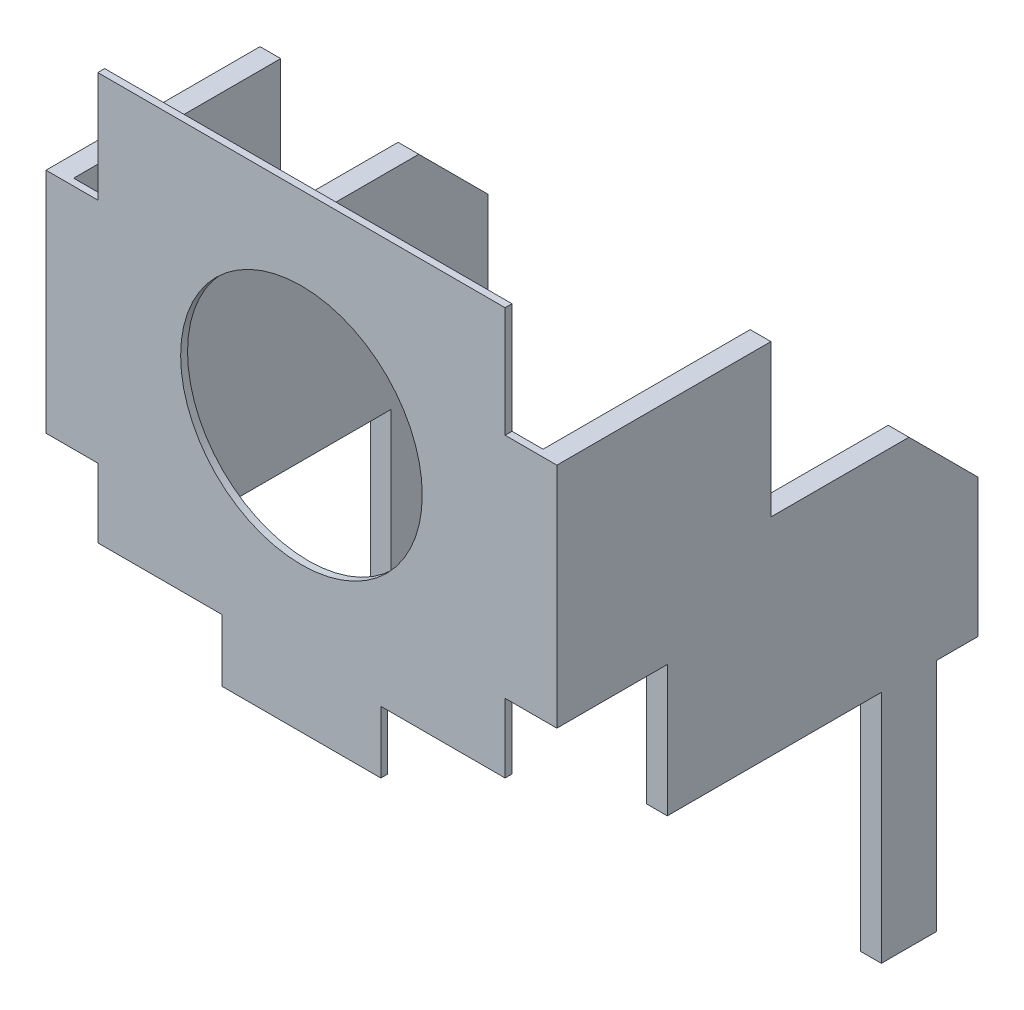
from build123d import *

# Parameters (mm, degrees)
SKETCH1_R                = 1.75
BOSS_EXTRUDE1_DEPTH      = 0.1
SKETCH2_W                = 0.3
SKETCH2_H                = 3.3
BOSS_EXTRUDE2_DEPTH      = 3
BOSS_EXTRUDE3_DEPTH      = 3
BOSS_EXTRUDE3_DEPTH_BACK = 1.5
SKETCH3_W                = 0.3
SKETCH3_H                = 3
CUT_EXTRUDE1_DEPTH       = 11.725320508
CUT_EXTRUDE1_DEPTH_BACK  = 11.725320508
SKETCH6_W                = 0.3
SKETCH6_H                = 0.8
BOSS_EXTRUDE4_DEPTH      = 3.4


with BuildPart() as part:
    # Sketch1 → Boss-Extrude1 (new body)
    with BuildSketch(Plane.XY):
        Polygon((1.8, 0), (1.8, -0.9), (4.1, -0.9), (4.1, 0), (5.9, 0), (5.9, 1), (6.65, 1), (6.65, 4.3), (5.9, 4.3), (5.9, 5.9), (0, 5.9), (0, 4.3), (-0.75, 4.3), (-0.75, 1), (0, 1), (0, 0), align=None)
        with Locations((2.95, 2.95)):
            Circle(SKETCH1_R, mode=Mode.SUBTRACT)
    extrude(amount=BOSS_EXTRUDE1_DEPTH)

    # Sketch2 → Boss-Extrude2 (add)
    with BuildSketch(Plane(origin=(0, 0, 0), x_dir=(-1, 0, 0), z_dir=(0, 0, -1))):
        with Locations((-6.5, 2.65)):
            Rectangle(SKETCH2_W, SKETCH2_H)
        with Locations((0.6, 2.65)):
            Rectangle(SKETCH2_W, SKETCH2_H)
    extrude(amount=BOSS_EXTRUDE2_DEPTH)

    # Sketch3 → Boss-Extrude3 (add, two sides: drawn at the far end of the back side and taken through both)
    with BuildSketch(Plane(origin=(0, 0, -3), x_dir=(-1, 0, 0), z_dir=(0, 0, -1)).offset(-BOSS_EXTRUDE3_DEPTH_BACK)):
        with Locations((0.6, 0.6)):
            Rectangle(SKETCH3_W, SKETCH3_H)
        with Locations((-6.5, 0.6)):
            Rectangle(SKETCH3_W, SKETCH3_H)
    extrude(amount=BOSS_EXTRUDE3_DEPTH + BOSS_EXTRUDE3_DEPTH_BACK)

    # Sketch5 → Cut-Extrude1 (cut, two sides: drawn at the far end of the back side and taken through both)
    with BuildSketch(Plane(origin=(0, 0, 0), x_dir=(0, 0, -1), z_dir=(1, 0, 0)).offset(-CUT_EXTRUDE1_DEPTH_BACK)):
        Polygon((5, 2.1), (6, 1.1), (6, 2.1), align=None)
    extrude(amount=CUT_EXTRUDE1_DEPTH + CUT_EXTRUDE1_DEPTH_BACK, mode=Mode.SUBTRACT)

    # Sketch6 → Boss-Extrude4 (add)
    with BuildSketch(Plane.XZ.offset(0.9)):
        with Locations((-0.6, -5)):
            Rectangle(SKETCH6_W, SKETCH6_H)
        with Locations((6.5, -5)):
            Rectangle(SKETCH6_W, SKETCH6_H)
    extrude(amount=BOSS_EXTRUDE4_DEPTH)


solid = part.part
